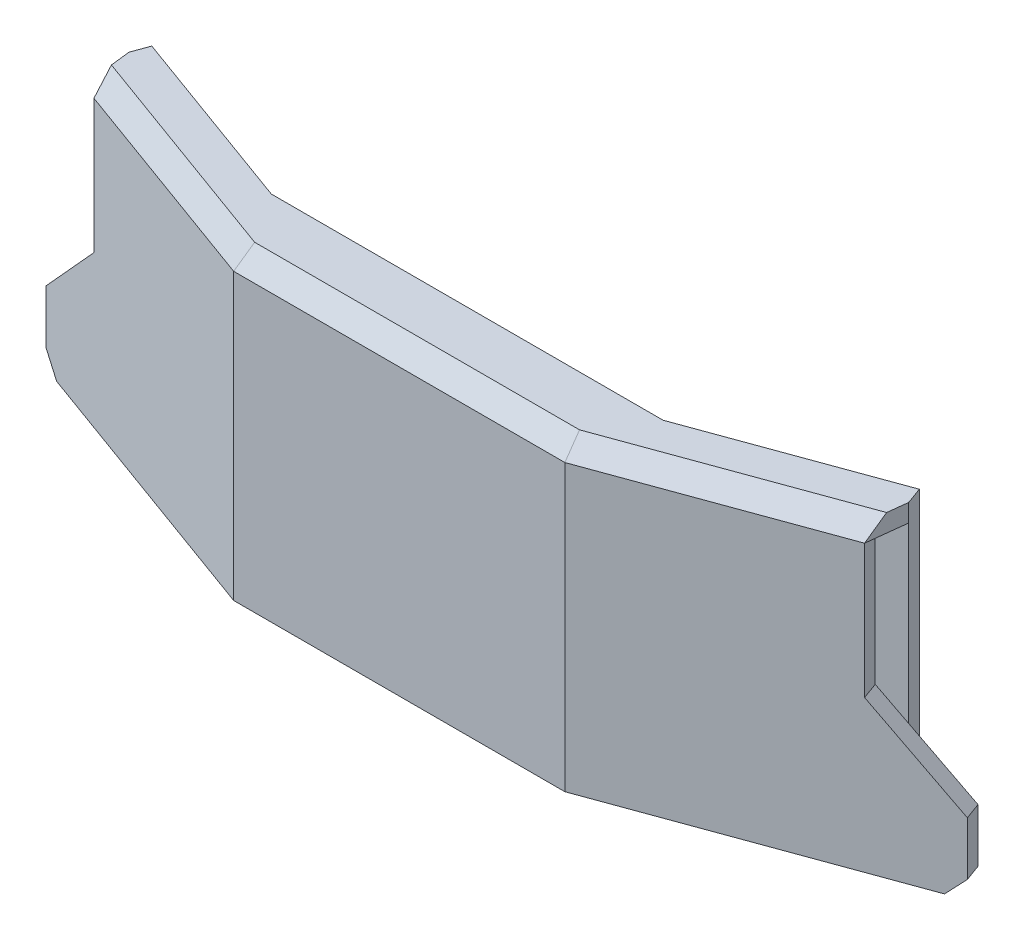
from build123d import *

# Parameters (mm, degrees)
BOSS_EXTRUDE5_DEPTH = 30
BOSS_EXTRUDE6_DEPTH = 2
BOSS_EXTRUDE7_DEPTH = 2
CHAMFER2_SIZE       = 2
CHAMFER3_SIZE       = 2
BOSS_EXTRUDE8_DEPTH = 2
BOSS_EXTRUDE9_DEPTH = 2
CHAMFER4_SIZE       = 2


with BuildPart() as part:
    # Sketch5 → Boss-Extrude5 (new body)
    with BuildSketch(Plane(origin=(0, 0, 0), x_dir=(1, 0, 0), z_dir=(0, 1, 0))):
        Polygon((-40, 10.050874286), (-40.684040287, 8.171489044), (-42.563425528, 8.855529331), (-43.247465815, 6.976144089), (-18.585712616, -2), (18.585712616, -2), (43.247465815, 6.976144089), (42.563425528, 8.855529331), (40.684040287, 8.171489044), (40, 10.050874286), (43.758770483, 11.418954859), (43.074730196, 13.2983401), (37.436574472, 11.24621924), (37.436574472, 6.989508151), (18.233058655, 0), (-18.233058655, 0), (-37.436574472, 6.989508151), (-37.436574472, 11.24621924), (-43.074730196, 13.2983401), (-43.758770483, 11.418954859), align=None)
    extrude(amount=BOSS_EXTRUDE5_DEPTH)

    # Sketch6 → Boss-Extrude6 (add)
    with BuildSketch(Plane(origin=(0, 30, 0), x_dir=(1, 0, 0), z_dir=(0, 1, 0))):
        Polygon((-43.758770483, 11.418954859), (-43.247465815, 6.976144089), (-18.585712616, -2), (18.585712616, -2), (43.247465815, 6.976144089), (43.758770483, 11.418954859), (43.074730196, 13.2983401), (37.436574472, 11.24621924), (21.987207763, 5.62310962), (-21.987207763, 5.62310962), (-37.436574472, 11.24621924), (-43.074730196, 13.2983401), align=None)
    extrude(amount=BOSS_EXTRUDE6_DEPTH)

    # Sketch7 → Boss-Extrude7 (add)
    with BuildSketch(Plane.XZ):
        Polygon((-43.247465815, -6.976144089), (-42.563425528, -8.855529331), (-18.233058655, 0), (18.233058655, 0), (42.563425528, -8.855529331), (43.247465815, -6.976144089), (18.585712616, 2), (-18.585712616, 2), align=None)
    extrude(amount=BOSS_EXTRUDE7_DEPTH)

    # Chamfer2
    chamfer2_edges = [part.edges().sort_by_distance(p)[0] for p in [
        (30.916589216, 32, -2.488072045),
        (0, 32, 2),
        (-30.916589216, 32, -2.488072045),
    ]]
    chamfer(chamfer2_edges, length=CHAMFER2_SIZE)

    # Chamfer3
    chamfer3_edges = [part.edges().sort_by_distance(p)[0] for p in [
        (-42.905445672, -2, -7.91583671),
        (42.905445672, -2, -7.91583671),
    ]]
    chamfer(chamfer3_edges, length=CHAMFER3_SIZE)

    # Sketch10 → Boss-Extrude8 (add)
    with BuildSketch(Plane(origin=(-2.816902982, 0, 7.739377337), x_dir=(0.9396926207859265, 0, 0.34202014332561875), z_dir=(-0.34202014332561875, 0, 0.9396926207859265))):
        Polygon((-41.025306295, -2), (-43.025306295, 0), (-43.025306295, 15), (-52.025306295, 6), (-52.025306295, -2), align=None)
    extrude(amount=-BOSS_EXTRUDE8_DEPTH)

    # Sketch11 → Boss-Extrude9 (add)
    with BuildSketch(Plane(origin=(2.816902982, 0, 7.739377337), x_dir=(0.9396926207859748, 0, -0.342020143325486), z_dir=(0.3420201433254861, 0, 0.9396926207859749))):
        Polygon((41.025306295, -2), (43.025306295, 0), (43.025306295, 15), (52.025306295, 6), (52.025306295, -2), align=None)
    extrude(amount=-BOSS_EXTRUDE9_DEPTH)

    # Chamfer4
    chamfer4_edges = [part.edges().sort_by_distance(p)[0] for p in [
        (-51.362679259, -2, -10.994018),
        (51.362679259, -2, -10.994018),
    ]]
    chamfer(chamfer4_edges, length=CHAMFER4_SIZE)


solid = part.part
